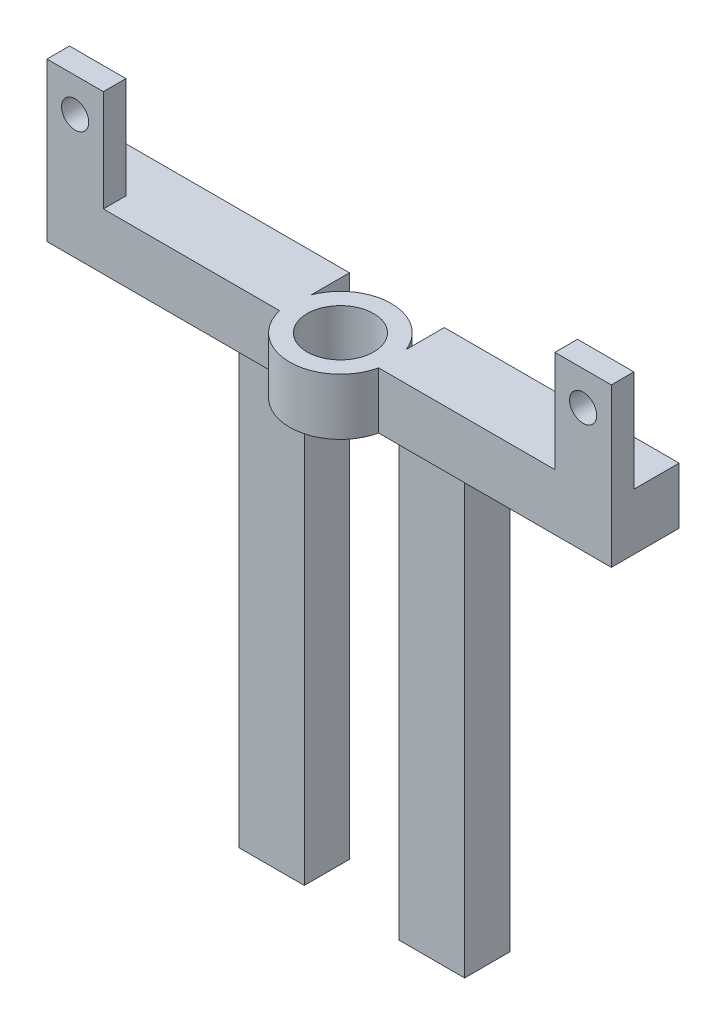
from build123d import *

# Parameters (mm, degrees)
BOSS_EXTRUDE1_START     = 26.5
SKETCH2_R               = 1.2
BOSS_EXTRUDE1_DEPTH     = 2
BOSS_EXTRUDE2_START     = -26.75
SKETCH3_R               = 4.5
BOSS_EXTRUDE2_DEPTH     = 5
CUT_EXTRUDE1_DEPTH      = 41.783728373
CUT_EXTRUDE1_DEPTH_BACK = 41.783728373
SKETCH4_R               = 2.95
BOSS_EXTRUDE3_START     = -4
SKETCH5_W               = 15
SKETCH5_H               = 5
BOSS_EXTRUDE3_DEPTH     = 4
BOSS_EXTRUDE6_START     = -26.75
SKETCH6_W               = 5.8
SKETCH6_H               = 4
BOSS_EXTRUDE6_DEPTH     = 45


with BuildPart() as part:
    # Sketch2 → Boss-Extrude1 (new body)
    with BuildSketch(Plane.XY.offset(-26.5).offset(BOSS_EXTRUDE1_START)):
        Polygon((-25, -17.75), (-20, -17.75), (-20, -26.75), (20, -26.75), (20, -17.75), (25, -17.75), (25, -31.75), (-25, -31.75), align=None)
        with Locations((22.5, -20.75)):
            Circle(SKETCH2_R, mode=Mode.SUBTRACT)
        with Locations((-22.5, -20.75)):
            Circle(SKETCH2_R, mode=Mode.SUBTRACT)
    extrude(amount=BOSS_EXTRUDE1_DEPTH)

    # Sketch3 → Boss-Extrude2 (add)
    with BuildSketch(Plane(origin=(0, 0, 0), x_dir=(1, 0, 0), z_dir=(0, 1, 0)).offset(BOSS_EXTRUDE2_START)):
        with Locations((0, -1)):
            Circle(SKETCH3_R)
    extrude(amount=-BOSS_EXTRUDE2_DEPTH)

    # Sketch4 → Cut-Extrude1 (cut, two sides: drawn at the far end of the back side and taken through both)
    with BuildSketch(Plane(origin=(0, 0, 0), x_dir=(1, 0, 0), z_dir=(0, 1, 0)).offset(-CUT_EXTRUDE1_DEPTH_BACK)):
        with Locations(Location((0, -1, 0), (0, 0, 270))):
            Circle(SKETCH4_R)
    extrude(amount=CUT_EXTRUDE1_DEPTH + CUT_EXTRUDE1_DEPTH_BACK, mode=Mode.SUBTRACT)

    # Sketch5 → Boss-Extrude3 (add)
    with BuildSketch(Plane.XY.offset(BOSS_EXTRUDE3_START)):
        with Locations((17.5, -29.25)):
            Rectangle(SKETCH5_W, SKETCH5_H)
        with Locations((-17.5, -29.25)):
            Rectangle(SKETCH5_W, SKETCH5_H)
    extrude(amount=BOSS_EXTRUDE3_DEPTH)

    # Sketch6 → Boss-Extrude6 (add)
    with BuildSketch(Plane(origin=(0, 0, 0), x_dir=(1, 0, 0), z_dir=(0, 1, 0)).offset(BOSS_EXTRUDE6_START)):
        with Locations((7.1, 2)):
            Rectangle(SKETCH6_W, SKETCH6_H)
        with Locations((-7.1, 2)):
            Rectangle(SKETCH6_W, SKETCH6_H)
    extrude(amount=-BOSS_EXTRUDE6_DEPTH)


solid = part.part
